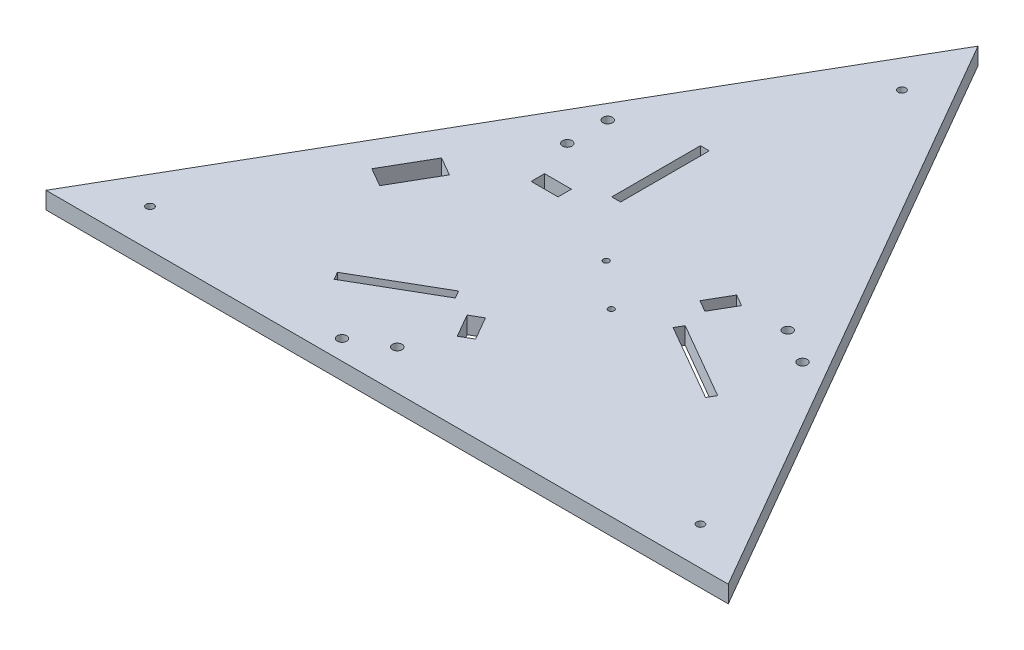
from build123d import *

# Parameters (mm, degrees)
BOSS_EXTRUDE1_DEPTH = 6.35
SKETCH2_W           = 3.302
SKETCH2_H           = 33.02
SKETCH2_R           = 1.778
CUT_EXTRUDE1_DEPTH  = 195.099602868
SKETCH3_R           = 1.4224
SKETCH3_W           = 10
SKETCH3_H           = 5
CUT_EXTRUDE2_DEPTH  = 195.099602868
SKETCH4_R           = 1.0922
CUT_EXTRUDE3_DEPTH  = 195.099602868


with BuildPart() as part:
    # Sketch1 → Boss-Extrude1 (new body)
    with BuildSketch(Plane(origin=(0, 0, 0), x_dir=(1, 0, 0), z_dir=(0, 1, 0))):
        Polygon((0, 146.646968374), (-127, -73.323484187), (127, -73.323484187), align=None)
    extrude(amount=BOSS_EXTRUDE1_DEPTH)

    # Sketch2 → Cut-Extrude1 (cut, through all)
    with BuildSketch(Plane(origin=(0, 6.35, 0), x_dir=(1, 0, 0), z_dir=(0, 1, 0))):
        with Locations((-17.907, 46.362701567)):
            Rectangle(SKETCH2_W, SKETCH2_H)
        Polygon((-16.074197928, -31.864075631), (-17.725197928, -29.004459747), (-46.321356761, -45.514459747), (-44.670356761, -48.374075631), align=None)
        with Locations(Location((-11.086716778, -58.463540546, 0), (0, 0, 270))):
            Circle(SKETCH2_R)
        with Locations(Location((-24.128284992, -65.993093465, 0), (0, 0, 270))):
            Circle(SKETCH2_R)
        Polygon((64.228356761, -14.498625936), (35.632197928, 2.011374064), (33.981197928, -0.848241819), (62.577356761, -17.358241819), align=None)
        with Locations(Location((56.174269697, 19.630391899, 0), (0, 0, 270))):
            Circle(SKETCH2_R)
        with Locations(Location((69.215837912, 12.100838979, 0), (0, 0, 270))):
            Circle(SKETCH2_R)
        Polygon((-56.873789915, 6.738674622), (-66.373789915, -9.71580805), (-73.301993146, -5.71580805), (-63.801993146, 10.738674622), align=None)
        with Locations(Location((-45.087552919, 53.892254486, 0), (0, 0, 270))):
            Circle(SKETCH2_R)
        with Locations(Location((-45.087552919, 38.833148648, 0), (0, 0, 270))):
            Circle(SKETCH2_R)
    extrude(amount=-CUT_EXTRUDE1_DEPTH, mode=Mode.SUBTRACT)

    # Sketch3 → Cut-Extrude2 (cut, through all)
    with BuildSketch(Plane(origin=(0, 6.35, 0), x_dir=(1, 0, 0), z_dir=(0, 1, 0))):
        with Locations(Location((0, 118.312139176, 0), (0, 0, 270))):
            Circle(SKETCH3_R)
        with Locations(Location((-102.461318102, -59.156069588, 0), (0, 0, 270))):
            Circle(SKETCH3_R)
        with Locations(Location((102.461318102, -59.156069588, 0), (0, 0, 270))):
            Circle(SKETCH3_R)
        with Locations((-34.558, 22.352701567)):
            Rectangle(SKETCH3_W, SKETCH3_H)
        Polygon((0.935056109, -41.324967823), (-4.064943891, -32.664713785), (-8.395070909, -35.164713785), (-3.395070909, -43.824967823), align=None)
        Polygon((35.320943891, 21.472266256), (30.320943891, 12.812012218), (34.651070909, 10.312012218), (39.651070909, 18.972266256), align=None)
    extrude(amount=-CUT_EXTRUDE2_DEPTH, mode=Mode.SUBTRACT)

    # Sketch4 → Cut-Extrude3 (cut, through all)
    with BuildSketch(Plane(origin=(0, 6.35, 0), x_dir=(1, 0, 0), z_dir=(0, 1, 0))):
        with Locations(Location((0, 8.207705491, 0), (0, 0, 270))):
            Circle(SKETCH4_R)
        with Locations(Location((16.51, -6.397294509, 0), (0, 0, 270))):
            Circle(SKETCH4_R)
    extrude(amount=-CUT_EXTRUDE3_DEPTH, mode=Mode.SUBTRACT)


solid = part.part
